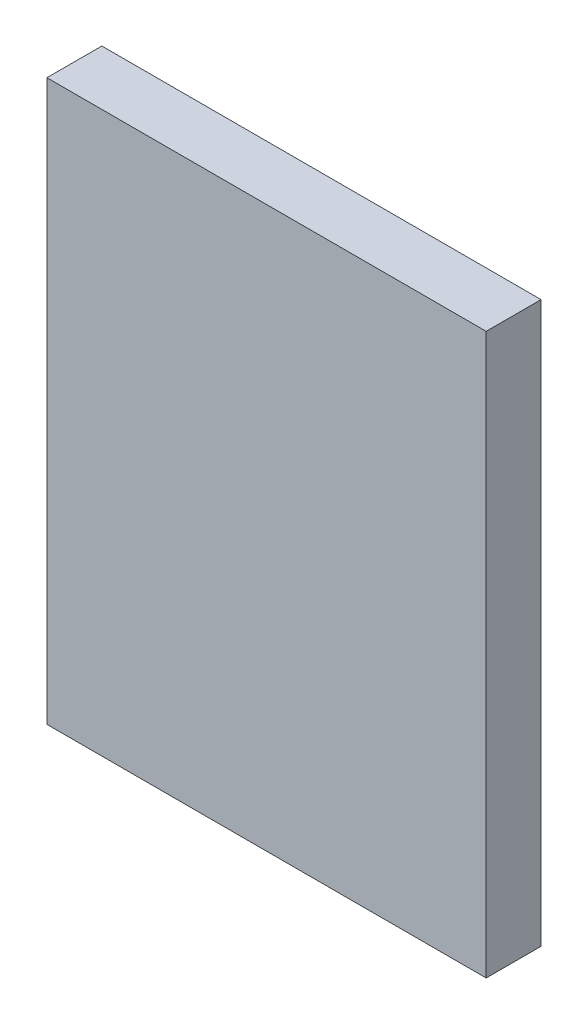
from build123d import *

# Parameters (mm, degrees)
SZKIC1_W                    = 40
SZKIC1_H                    = 51
DODANIE_WYCI_GNI_CIE1_DEPTH = 5


with BuildPart() as part:
    # Szkic1 → Dodanie-wyciągnięcie1 (new body)
    with BuildSketch(Plane.XY):
        Rectangle(SZKIC1_W, SZKIC1_H)
    extrude(amount=DODANIE_WYCI_GNI_CIE1_DEPTH)


solid = part.part
